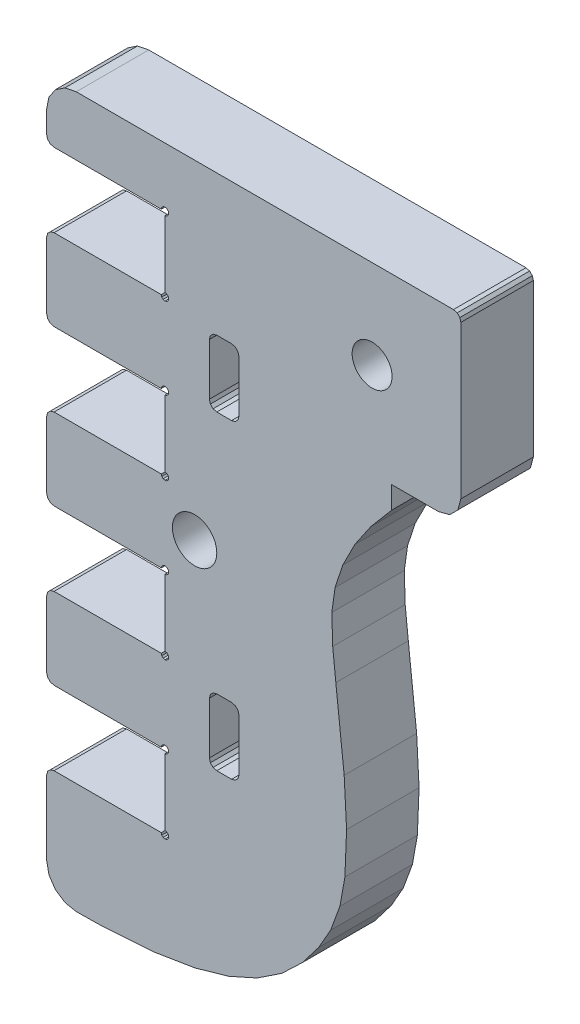
from build123d import *

# Parameters (mm, degrees)
ESQUISSE1_R        = 1.35
ESQUISSE1_R_2      = 1.5
BOSS_EXTRU_1_DEPTH = 4.9


with BuildPart() as part:
    # Esquisse1 → Boss.-Extru.1 (new body)
    with BuildSketch(Plane.XY.offset(377.0447)):
        Polygon((15.891185209, 3.330523996), (17.295074786, 4.667009593), (18.397064454, 6.110993158), (19.198464212, 7.515709734), (19.829414022, 9.236036216), (20.160733922, 11.107826651), (20.275133888, 13.944835796), (20.111733937, 17.038324864), (19.548124107, 22.181683313), (19.336824171, 24.193402707), (19.277384189, 26.157782114), (19.497574122, 27.722941643), (20.015153966, 29.300491167), (20.842573717, 30.928140676), (21.916433393, 32.504840201), (23.323482969, 34.1655297), (23.323482969, 35.665529248), (26.499992011, 35.665529248), (27.249991785, 35.866489188), (27.79903162, 36.415529022), (27.999991559, 37.165528796), (27.999991559, 47.499985681), (27.933001579, 47.749985605), (27.749991634, 47.93299555), (27.49999171, 47.99998553), (1.999999397, 47.99998553), (1.234632628, 47.847745576), (0.585786323, 47.414205706), (0.152240954, 46.765355902), (0, 45.999986133), (0, 44.499986585), (0.06698734, 44.24998666), (0.249999925, 44.066976716), (0.499999949, 43.999986736), (7.749997664, 43.999986736), (7.783491654, 44.124986698), (7.874997626, 44.21649667), (7.999997588, 44.24998666), (8.124997551, 44.21649667), (8.216504523, 44.124986698), (8.249997513, 43.999986736), (8.216504523, 43.874986773), (8.124997551, 43.783476801), (7.999997588, 43.749986811), (7.999997588, 39.249988168), (8.124997551, 39.216498178), (8.216504523, 39.124988205), (8.249997513, 38.999988243), (8.216504523, 38.874988281), (8.124997551, 38.783478308), (7.999997588, 38.749988318), (7.874997626, 38.783478308), (7.783491654, 38.874988281), (7.749997664, 38.999988243), (0.499999949, 38.999988243), (0.249999925, 38.932998263), (0.06698734, 38.749988318), (0, 38.499988394), (0, 33.99998975), (0.06698734, 33.749989826), (0.249999925, 33.566979881), (0.499999949, 33.499989901), (7.749997664, 33.499989901), (7.783491654, 33.624989863), (7.874997626, 33.716499836), (7.999997588, 33.749989826), (8.124997551, 33.716499836), (8.216504523, 33.624989863), (8.249997513, 33.499989901), (8.216504523, 33.374989939), (8.124997551, 33.283479966), (7.999997588, 33.249989976), (7.999997588, 28.749991333), (8.124997551, 28.716501343), (8.216504523, 28.624991371), (8.249997513, 28.499991408), (8.216504523, 28.374991446), (8.124997551, 28.283481474), (7.999997588, 28.249991484), (7.874997626, 28.283481474), (7.783491654, 28.374991446), (7.749997664, 28.499991408), (0.499999949, 28.499991408), (0.249999925, 28.433001429), (0.06698734, 28.249991484), (0, 27.999991559), (0, 23.499992916), (0.06698734, 23.249992991), (0.249999925, 23.066983046), (0.499999949, 22.999993066), (7.749997664, 22.999993066), (7.783491654, 23.124993029), (7.874997626, 23.216503001), (7.999997588, 23.249992991), (8.124997551, 23.216503001), (8.216504523, 23.124993029), (8.249997513, 22.999993066), (8.216504523, 22.874993104), (8.124997551, 22.783483132), (7.999997588, 22.749993142), (7.999997588, 18.249994498), (8.124997551, 18.216504508), (8.216504523, 18.124994536), (8.249997513, 17.999994574), (8.216504523, 17.874994611), (8.124997551, 17.783484639), (7.999997588, 17.749994649), (7.874997626, 17.783484639), (7.783491654, 17.874994611), (7.749997664, 17.999994574), (0.499999949, 17.999994574), (0.249999925, 17.933004594), (0.06698734, 17.749994649), (0, 17.499994724), (0, 12.999996081), (0.06698734, 12.749996156), (0.249999925, 12.566986212), (0.499999949, 12.499996232), (7.749997664, 12.499996232), (7.783491654, 12.624996194), (7.874997626, 12.716506166), (7.999997588, 12.749996156), (8.124997551, 12.716506166), (8.216504523, 12.624996194), (8.249997513, 12.499996232), (8.216504523, 12.374996269), (8.124997551, 12.283486297), (7.999997588, 12.249996307), (7.999997588, 7.749997664), (8.124997551, 7.716503674), (8.216504523, 7.624997701), (8.249997513, 7.499997739), (8.216504523, 7.374997777), (8.124997551, 7.283491804), (7.999997588, 7.249997814), (7.874997626, 7.283491804), (7.783491654, 7.374997777), (7.749997664, 7.499997739), (0.499999949, 7.499997739), (0.249999925, 7.433009759), (0.06698734, 7.249997814), (0, 6.99999789), (0, 1.999999397), (0.152240954, 1.234632628), (0.585786323, 0.585786223), (1.234632628, 0.152240854), (1.999999397, 0), (3.776477862, 0.025545672), (7.248430815, 0.262472121), (10.036716974, 0.718076284), (12.321666285, 1.373609586), (14.238535708, 2.233213327), align=None)
        with Locations((21.999992961, 41.999982339)):
            Circle(ESQUISSE1_R, mode=Mode.SUBTRACT)
        with Locations((9.99999793, 25.749992786)):
            Circle(ESQUISSE1_R_2, mode=Mode.SUBTRACT)
        Polygon((12.933006101, 13.249996006), (12.749996156, 13.066986061), (12.499996232, 12.999996081), (11.499996533, 12.999996081), (11.249996609, 13.066986061), (11.066986664, 13.249996006), (10.999996684, 13.49999593), (10.999996684, 16.999994875), (11.066986664, 17.2499948), (11.249996609, 17.433004745), (11.499996533, 17.499994724), (12.499996232, 17.499994724), (12.749996156, 17.433004745), (12.933006101, 17.2499948), (12.999996081, 16.999994875), (12.999996081, 13.49999593), align=None, mode=Mode.SUBTRACT)
        Polygon((11.249996609, 34.06697973), (11.066986664, 34.249989675), (10.999996684, 34.4999896), (10.999996684, 37.999988544), (11.066986664, 38.249988469), (11.249996609, 38.432998414), (11.499996533, 38.499988394), (12.499996232, 38.499988394), (12.749996156, 38.432998414), (12.933006101, 38.249988469), (12.999996081, 37.999988544), (12.999996081, 34.4999896), (12.933006101, 34.249989675), (12.749996156, 34.06697973), (12.499996232, 33.99998975), (11.499996533, 33.99998975), align=None, mode=Mode.SUBTRACT)
    extrude(amount=-BOSS_EXTRU_1_DEPTH)


solid = part.part
